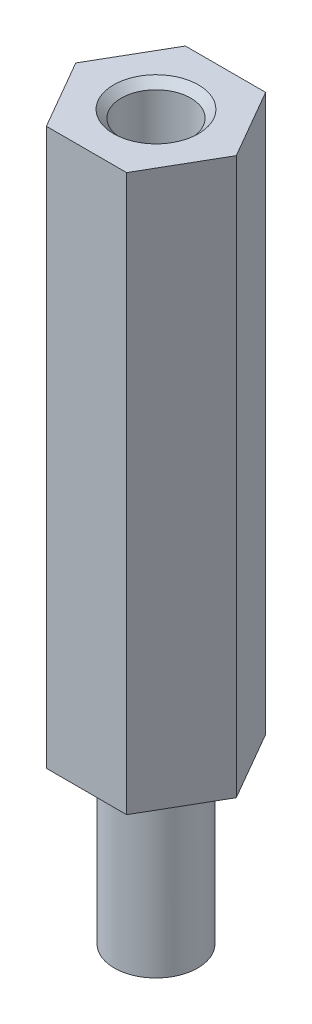
from build123d import *

# Parameters (mm, degrees)
BOSS_EXTRUDE1_DEPTH             = 20
M3X0_5_TAPPED_HOLE1_D           = 2.5
M3X0_5_TAPPED_HOLE1_DEPTH       = 8.5
M3X0_5_TAPPED_HOLE1_CSINK_D     = 3.05
M3X0_5_TAPPED_HOLE1_CSINK_ANGLE = 90
M3X0_5_TAPPED_HOLE1_TIP         = 0.751075774
SKETCH4_R                       = 1.5
BOSS_EXTRUDE2_DEPTH             = 6


with BuildPart() as part:
    # Sketch1 → Boss-Extrude1 (new body)
    with BuildSketch(Plane(origin=(0, 0, 0), x_dir=(1, 0, 0), z_dir=(0, 1, 0))):
        Polygon((2.886751346, 0), (1.443375673, 2.5), (-1.443375673, 2.5), (-2.886751346, 0), (-1.443375673, -2.5), (1.443375673, -2.5), align=None)
    extrude(amount=BOSS_EXTRUDE1_DEPTH)

    # M3x0.5 Tapped Hole1
    with Locations(Plane(origin=(0, 20, 0), x_dir=(1, 0, 0), z_dir=(0, 1, 0))):
        with Locations((0, 0)):
            CounterSinkHole(M3X0_5_TAPPED_HOLE1_D / 2, M3X0_5_TAPPED_HOLE1_CSINK_D / 2, depth=M3X0_5_TAPPED_HOLE1_DEPTH, counter_sink_angle=M3X0_5_TAPPED_HOLE1_CSINK_ANGLE)
            with Locations((0, 0, -(M3X0_5_TAPPED_HOLE1_DEPTH + M3X0_5_TAPPED_HOLE1_TIP / 2))):  # 118° drill point
                Cone(0, M3X0_5_TAPPED_HOLE1_D / 2, M3X0_5_TAPPED_HOLE1_TIP, mode=Mode.SUBTRACT)

    # Sketch4 → Boss-Extrude2 (add)
    with BuildSketch(Plane.XZ):
        with Locations(Location((0, 0, 0), (0, 0, 90))):
            Circle(SKETCH4_R)
    extrude(amount=BOSS_EXTRUDE2_DEPTH)


solid = part.part
